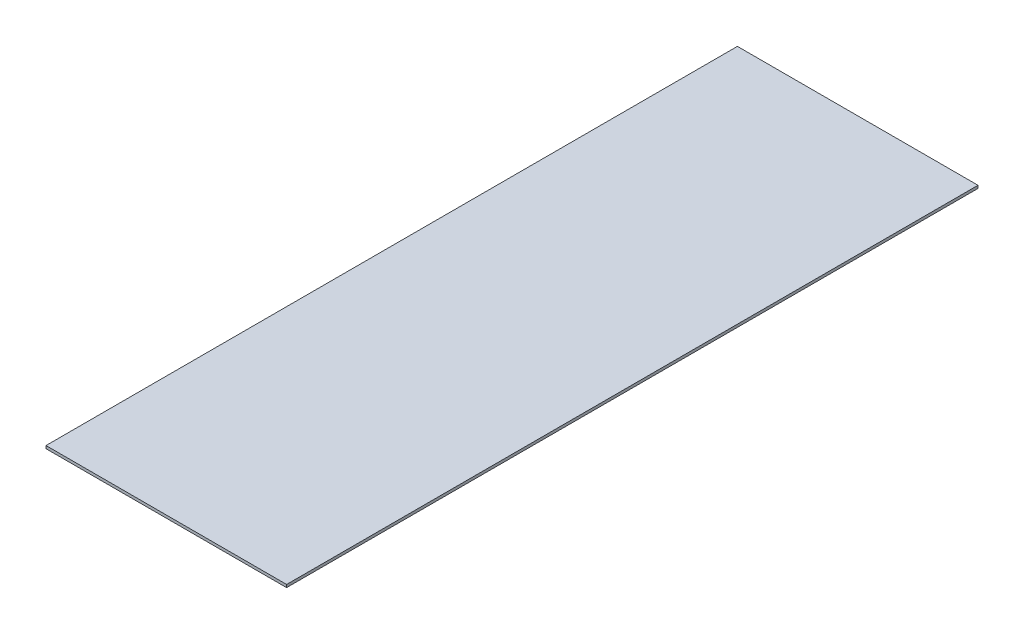
from build123d import *

# Parameters (mm, degrees)
SKETCH1_W           = 174
SKETCH1_H           = 500
BOSS_EXTRUDE1_DEPTH = 2


with BuildPart() as part:
    # Sketch1 → Boss-Extrude1 (new body)
    with BuildSketch(Plane(origin=(0, 0, 0), x_dir=(1, 0, 0), z_dir=(0, 1, 0))):
        with Locations((-87, -250)):
            Rectangle(SKETCH1_W, SKETCH1_H)
    extrude(amount=BOSS_EXTRUDE1_DEPTH)


solid = part.part
